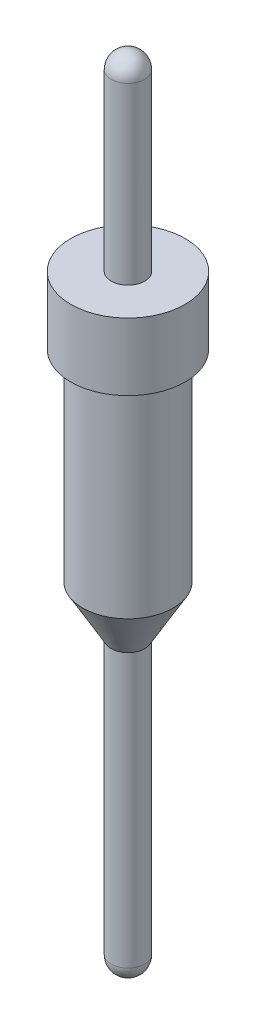
from build123d import *


with BuildPart() as part:
    # Sketch1 → Revolve1 (revolve)
    with BuildSketch(Plane.XY, mode=Mode.PRIVATE) as revolve1_sk:
        with BuildLine():
            Line((-0.85, 0), (-0.85, -1))
            Line((-0.85, -1), (-0.675, -1))
            Line((-0.675, -1), (-0.675, -4))
            Line((-0.675, -4), (-0.25, -4.736121593))
            Line((-0.25, -4.736121593), (-0.25, -8.8))
            ThreePointArc((-0.25, -8.8), (-0.176776695, -8.976776695), (0, -9.05))
            Line((0, -9.05), (0, 2.85))
            ThreePointArc((0, 2.85), (-0.176776695, 2.776776695), (-0.25, 2.6))
            Line((-0.25, 2.6), (-0.25, 0))
            Line((-0.25, 0), (-0.85, 0))
        make_face()
    revolve(revolve1_sk.sketch.rotate(Axis((0, 28.992562867, 0), (0, -1, 0)), 270), axis=Axis((0, 28.992562867, 0), (0, -1, 0)))


solid = part.part
